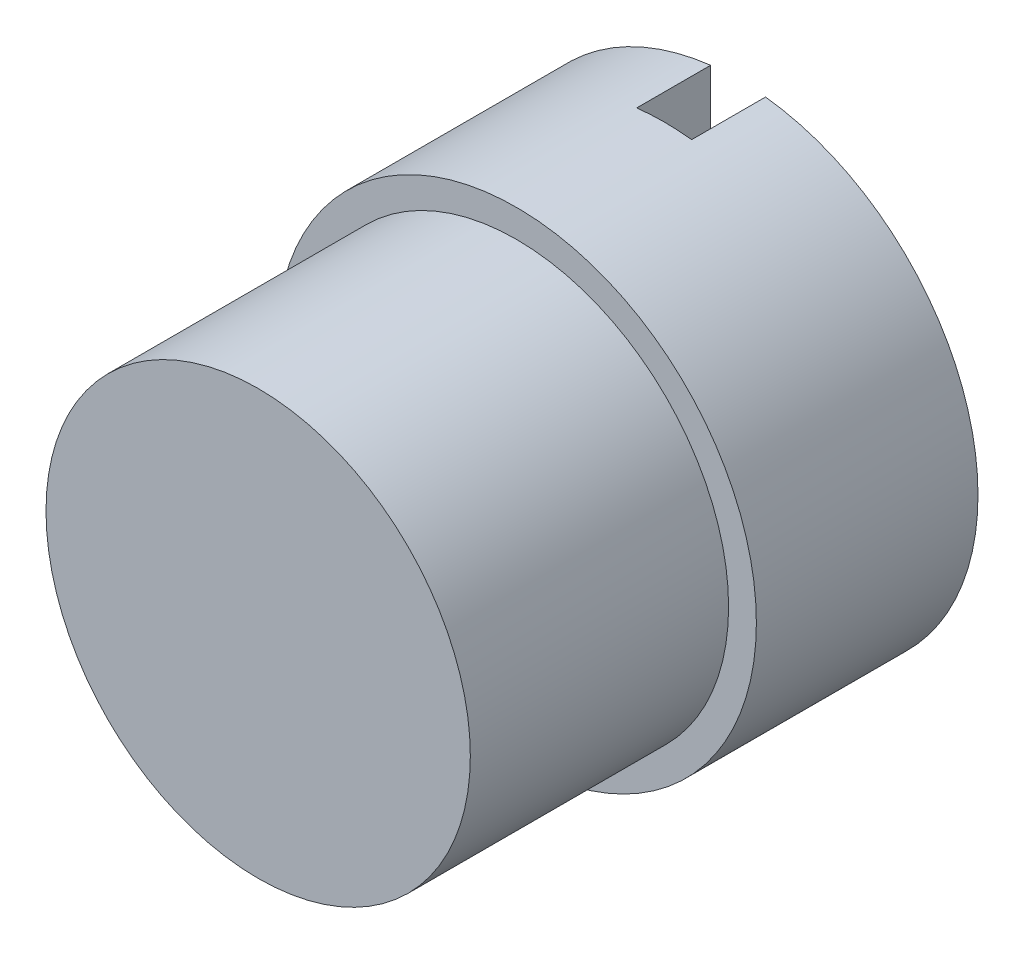
from build123d import *

# Parameters (mm, degrees)
SKETCH1_R               = 10.3124
SKETCH1_R_2             = 6.5405
BOSS_EXTRUDE1_DEPTH     = 9.525
SKETCH2_R               = 9.1186
BOSS_EXTRUDE2_DEPTH     = 11.0998
CUT_EXTRUDE1_DEPTH      = 19.327486122
CUT_EXTRUDE1_DEPTH_BACK = 19.327486122
SKETCH3_W               = 2.3622
SKETCH3_H               = 3.175


with BuildPart() as part:
    # Sketch1 → Boss-Extrude1 (new body)
    with BuildSketch(Plane.XY):
        Circle(SKETCH1_R)
        Circle(SKETCH1_R_2, mode=Mode.SUBTRACT)
    extrude(amount=-BOSS_EXTRUDE1_DEPTH)

    # Sketch2 → Boss-Extrude2 (add)
    with BuildSketch(Plane.XY):
        Circle(SKETCH2_R)
    extrude(amount=BOSS_EXTRUDE2_DEPTH)

    # Sketch3 → Cut-Extrude1 (cut, two sides: drawn at the far end of the back side and taken through both)
    with BuildSketch(Plane(origin=(0, 0, 0), x_dir=(1, 0, 0), z_dir=(0, 1, 0)).offset(-CUT_EXTRUDE1_DEPTH_BACK)):
        with Locations((0, 7.9375)):
            Rectangle(SKETCH3_W, SKETCH3_H)
    extrude(amount=CUT_EXTRUDE1_DEPTH + CUT_EXTRUDE1_DEPTH_BACK, mode=Mode.SUBTRACT)


solid = part.part
